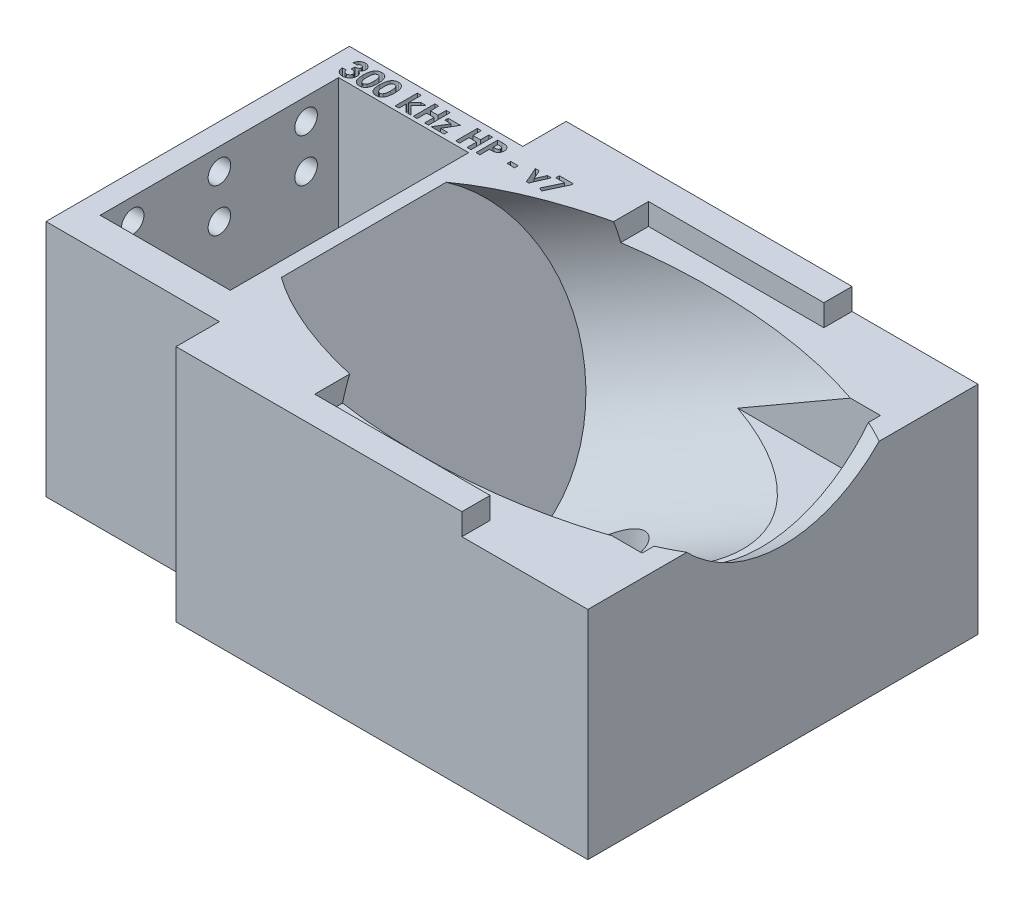
from build123d import *

# Parameters (mm, degrees)
SKETCH1_W                = 228.6
SKETCH1_H                = 127
BOSS_EXTRUDE1_DEPTH      = 50.8
SKETCH10_R               = 12.7
CUT_EXTRUDE6_DEPTH       = 196.514014843
SKETCH22_W               = 25.4
SKETCH22_H               = 101.6
CUT_EXTRUDE17_DEPTH      = 196.514014908
SKETCH23_W               = 254
SKETCH23_H               = 254
CUT_EXTRUDE18_DEPTH      = 57.15
SKETCH21_W               = 31.75
SKETCH21_H               = 101.6
CUT_EXTRUDE16_DEPTH      = 144.262530042
SKETCH26_W               = 63.5
SKETCH26_H               = 69.85
CUT_EXTRUDE21_DEPTH      = 25.4
CUT_EXTRUDE22_DEPTH      = 192.97594914
CUT_EXTRUDE22_DEPTH_BACK = 25.4
SKETCH27_R               = 3.302
SKETCH28_W               = 2.198076923
SKETCH28_H               = 1.058333333
CUT_EXTRUDE23_DEPTH      = 3.175
SKETCH30_R               = 3.429
CUT_EXTRUDE24_DEPTH      = 133.743860656
CUT_EXTRUDE25_DEPTH      = 133.743860656
CUT_EXTRUDE25_DEPTH_BACK = 38.1
SKETCH31_W               = 38.1
SKETCH31_H               = 69.85
SKETCH32_W               = 88.276157737
SKETCH32_H               = 97.79
CUT_EXTRUDE26_DEPTH      = 6.35
SKETCH33_W               = 36.899714507
SKETCH33_H               = 101.6
CUT_EXTRUDE27_DEPTH      = 6.35
BOSS_EXTRUDE2_DEPTH      = 6.35
BOSS_EXTRUDE3_DEPTH      = 6.35
SKETCH36_W               = 50.8
SKETCH36_H               = 12.7
CUT_EXTRUDE28_DEPTH      = 146.635280919


with BuildPart() as part:
    # Sketch1 → Boss-Extrude1 (new, symmetric)
    with BuildSketch(Plane.XY):
        with Locations((-25.4, -63.5)):
            Rectangle(SKETCH1_W, SKETCH1_H)
    extrude(amount=BOSS_EXTRUDE1_DEPTH, both=True)

    # Sketch10 → Cut-Extrude6 (cut, through all)
    with BuildSketch(Plane.XZ.offset(127)):
        with Locations(Location((0, 0, 0), (0, 0, 270))):
            Circle(SKETCH10_R)
    extrude(amount=-CUT_EXTRUDE6_DEPTH, mode=Mode.SUBTRACT)

    # Sketch2 → Cut-Revolve1 (revolve, cut)
    with BuildSketch(Plane.XY):
        Polygon((0, 46.586734405), (-47.920101674, 18.920050804), (-69.397531628, 6.520050839), (-50.142509297, -26.830626138), (-48.125031628, -30.324999965), (0, -2.54), (87.988181024, 48.26), (66.715681024, 85.105050804), align=None)
    revolve(axis=Axis((-48.125031628, -30.324999965, 0), (0.8660254037844379, 0.5000000000000012, 0)), mode=Mode.SUBTRACT)

    # Sketch22 → Cut-Extrude17 (cut, through all)
    with BuildSketch(Plane(origin=(0, 0, 0), x_dir=(1, 0, 0), z_dir=(0, 1, 0))):
        with Locations((-127, 0)):
            Rectangle(SKETCH22_W, SKETCH22_H)
    extrude(amount=-CUT_EXTRUDE17_DEPTH, mode=Mode.SUBTRACT)

    # Sketch23 → Cut-Extrude18 (cut)
    with BuildSketch(Plane.XZ.offset(127)):
        Rectangle(SKETCH23_W, SKETCH23_H)
    extrude(amount=-CUT_EXTRUDE18_DEPTH, mode=Mode.SUBTRACT)

    # Sketch21 → Cut-Extrude16 (cut, through all)
    with BuildSketch(Plane(origin=(0, 0, 0), x_dir=(1, 0, 0), z_dir=(0, 1, 0))):
        with Locations((73.025, 0)):
            Rectangle(SKETCH21_W, SKETCH21_H)
    extrude(amount=-CUT_EXTRUDE16_DEPTH, mode=Mode.SUBTRACT)

    # Sketch26 → Cut-Extrude21 (cut)
    with BuildSketch(Plane(origin=(0, 0, 0), x_dir=(1, 0, 0), z_dir=(0, 1, 0))):
        with Locations((19.05, 0)):
            Rectangle(SKETCH26_W, SKETCH26_H)
    extrude(amount=-CUT_EXTRUDE21_DEPTH, mode=Mode.SUBTRACT)

    # Sketch27 → Cut-Extrude22 (cut, two sides: drawn at the far end of the back side and taken through both)
    with BuildSketch(Plane.ZY.offset(114.3).offset(-CUT_EXTRUDE22_DEPTH_BACK)):
        with Locations(Location((-25.4, -6.35, 0), (0, 0, 180))):
            Circle(SKETCH27_R)
        with Locations(Location((0, -6.35, 0), (0, 0, 180))):
            Circle(SKETCH27_R)
        with Locations(Location((0, -19.05, 0), (0, 0, 180))):
            Circle(SKETCH27_R)
        with Locations(Location((25.4, -6.35, 0), (0, 0, 180))):
            Circle(SKETCH27_R)
        with Locations(Location((25.4, -19.05, 0), (0, 0, 180))):
            Circle(SKETCH27_R)
        with Locations(Location((-25.4, -19.05, 0), (0, 0, 180))):
            Circle(SKETCH27_R)
    extrude(amount=CUT_EXTRUDE22_DEPTH + CUT_EXTRUDE22_DEPTH_BACK, mode=Mode.SUBTRACT)

    # Sketch28 → Cut-Extrude23 (cut)
    # profile 1 of 11: a face of its own
    with BuildSketch(Plane(origin=(0, 0, 0), x_dir=(1, 0, 0), z_dir=(0, 1, 0))):
        with BuildLine():
            Line((-108.439595668, 40.823041991), (-109.579339258, 40.823041991))
            add(Edge.make_bspline(
                [(-109.579339258, 40.823041991), (-109.571292235, 40.880013707), (-109.555516579, 40.991702982), (-109.517767544, 41.15340123), (-109.472615625, 41.306783084), (-109.41624576, 41.451362816), (-109.35013308, 41.587397969), (-109.274949876, 41.71535535), (-109.18988339, 41.834685743), (-109.124679027, 41.906570845), (-109.092149755, 41.942433016)],
                knots=[0, 0, 0, 0, 1.111473889, 2.178970933, 3.205615836, 4.199322666, 5.174200091, 6.12565194, 7.064921805, 8, 8, 8, 8], degree=3))
            add(Edge.make_bspline(
                [(-109.092149755, 41.942433016), (-109.04523059, 41.989750553), (-108.952757848, 42.083008445), (-108.798225049, 42.202461503), (-108.636246138, 42.305840002), (-108.463572556, 42.387799223), (-108.282891233, 42.454135718), (-108.092765331, 42.498694091), (-107.893971771, 42.528258965), (-107.758320175, 42.531171208), (-107.689094867, 42.532657375)],
                knots=[0, 0, 0, 0, 1.01925491, 2.00884431, 2.983262333, 3.955970413, 4.92937149, 5.924503185, 6.940838805, 8, 8, 8, 8], degree=3))
            add(Edge.make_bspline(
                [(-107.689094867, 42.532657375), (-107.627550006, 42.531204422), (-107.506565211, 42.528348208), (-107.328748005, 42.505420072), (-107.15921418, 42.465206676), (-106.996171714, 42.412628563), (-106.84201843, 42.341087252), (-106.693352017, 42.258043018), (-106.554326218, 42.156185813), (-106.42461574, 42.041097423), (-106.305451927, 41.916618062), (-106.202255542, 41.783559862), (-106.113535759, 41.645477115), (-106.040442393, 41.501222613), (-105.984243527, 41.350552262), (-105.945239847, 41.194336462), (-105.919710992, 41.032919917), (-105.917167651, 40.923207266), (-105.915877719, 40.867563225)],
                knots=[0, 0, 0, 0, 1.091422571, 2.145516843, 3.172569842, 4.178562979, 5.178154469, 6.181868002, 7.194278174, 8.227918432, 9.254613415, 10.245994977, 11.209837596, 12.161663635, 13.10878368, 14.055455738, 15.013766427, 16, 16, 16, 16], degree=3))
            add(Edge.make_bspline(
                [(-105.915877719, 40.867563225), (-105.918524735, 40.798652714), (-105.923735896, 40.662989104), (-105.966497241, 40.464435331), (-106.033430374, 40.274582491), (-106.130121795, 40.09608691), (-106.251010699, 39.929434354), (-106.399337334, 39.780196517), (-106.570876975, 39.646033552), (-106.699654067, 39.573934358), (-106.765597271, 39.537014347)],
                knots=[0, 0, 0, 0, 0.992805628, 1.954529043, 2.915727527, 3.886831945, 4.871318353, 5.87440735, 6.911542536, 8, 8, 8, 8], degree=3))
            add(Edge.make_bspline(
                [(-106.765597271, 39.537014347), (-106.720334868, 39.522153747), (-106.631396276, 39.492953334), (-106.504980761, 39.435443453), (-106.384774052, 39.372594684), (-106.272846064, 39.299580983), (-106.16808354, 39.2193547), (-106.071125122, 39.13123003), (-105.981391508, 39.035399128), (-105.900347562, 38.931334959), (-105.828417893, 38.820701827), (-105.763879232, 38.706055293), (-105.710760316, 38.58565672), (-105.665761981, 38.460881142), (-105.631502811, 38.330607142), (-105.607381294, 38.195339519), (-105.593438465, 38.05538683), (-105.591311945, 37.960568968), (-105.590236694, 37.912625324)],
                knots=[0, 0, 0, 0, 1.059543567, 2.081955587, 3.086750234, 4.076226789, 5.052108497, 6.020845489, 6.989030705, 7.970690546, 8.952259656, 9.923888338, 10.895517021, 11.877585046, 12.873342345, 13.889638361, 14.932918083, 16, 16, 16, 16], degree=3))
            add(Edge.make_bspline(
                [(-105.590236694, 37.912625324), (-105.592416374, 37.842167634), (-105.596714258, 37.703239418), (-105.624038199, 37.498612373), (-105.674910453, 37.303518667), (-105.741835722, 37.11571345), (-105.831106766, 36.937621221), (-105.936163778, 36.765155005), (-106.065299953, 36.604295884), (-106.208812638, 36.450791159), (-106.368191842, 36.311231537), (-106.540984827, 36.190239624), (-106.723392024, 36.086407035), (-106.916567472, 36.002112782), (-107.120444057, 35.937196566), (-107.334567356, 35.890272133), (-107.559837056, 35.861562988), (-107.713601251, 35.858553379), (-107.792129723, 35.85701635)],
                knots=[0, 0, 0, 0, 1.005138573, 1.981928558, 2.936866704, 3.876260664, 4.820238198, 5.773547, 6.751179199, 7.756627054, 8.768222608, 9.766606018, 10.760583154, 11.757261445, 12.767156078, 13.807575856, 14.880313354, 16, 16, 16, 16], degree=3))
            add(Edge.make_bspline(
                [(-107.792129723, 35.85701635), (-107.86641639, 35.858636887), (-108.011674137, 35.861805633), (-108.224143994, 35.889232737), (-108.426076481, 35.933474881), (-108.617986934, 35.995837851), (-108.799132866, 36.076711966), (-108.971156979, 36.173014891), (-109.13062657, 36.290301154), (-109.279318443, 36.423276232), (-109.413934166, 36.57246672), (-109.53424892, 36.734416693), (-109.637609746, 36.909741981), (-109.724440526, 37.097693522), (-109.79406244, 37.298601039), (-109.848980002, 37.512055976), (-109.887340818, 37.738475358), (-109.899023685, 37.894256709), (-109.904980283, 37.973683016)],
                knots=[0, 0, 0, 0, 1.066544725, 2.085487077, 3.070979577, 4.031932826, 4.977951092, 5.916076795, 6.857635327, 7.814973522, 8.776389752, 9.738577119, 10.707772778, 11.69409279, 12.707140348, 13.757286496, 14.856535458, 16, 16, 16, 16], degree=3))
            Line((-109.904980283, 37.973683016), (-108.765236694, 37.973683016))
            add(Edge.make_bspline(
                [(-108.765236694, 37.973683016), (-108.758014257, 37.933746426), (-108.743946669, 37.855959444), (-108.7165087, 37.743341187), (-108.680753198, 37.639387579), (-108.639410942, 37.543174684), (-108.594755082, 37.453439261), (-108.540800124, 37.373495461), (-108.481499604, 37.301172481), (-108.395928521, 37.215194125), (-108.273598765, 37.126854954), (-108.108413067, 37.050084011), (-107.92465962, 37.005086807), (-107.796197635, 36.999597286), (-107.729799995, 36.996759939)],
                knots=[0, 0, 0, 0, 0.928156231, 1.807827665, 2.648129825, 3.438902246, 4.202261636, 4.936546065, 5.639352463, 6.338805438, 7.70633318, 9.064371875, 10.482673459, 12, 12, 12, 12], degree=3))
            add(Edge.make_bspline(
                [(-107.729799995, 36.996759939), (-107.69456706, 36.997364126), (-107.625553623, 36.998547592), (-107.524183161, 37.011664725), (-107.427613522, 37.033268655), (-107.335664841, 37.062627594), (-107.247751768, 37.09943086), (-107.165553968, 37.146886469), (-107.087396046, 37.202060389), (-107.01412765, 37.264090522), (-106.946426141, 37.331681163), (-106.890094505, 37.406526313), (-106.838611465, 37.482582364), (-106.800534238, 37.564825169), (-106.767170384, 37.648829187), (-106.746750001, 37.7376435), (-106.731331146, 37.829405024), (-106.730435064, 37.892202582), (-106.729980283, 37.924073641)],
                knots=[0, 0, 0, 0, 1.110435564, 2.175094844, 3.216326037, 4.226890168, 5.215276772, 6.21526065, 7.213097102, 8.228249917, 9.239874822, 10.221364777, 11.178138315, 12.128914389, 13.072518965, 14.022636769, 14.996447288, 16, 16, 16, 16], degree=3))
            add(Edge.make_bspline(
                [(-106.729980283, 37.924073641), (-106.73118764, 37.958930074), (-106.733591209, 38.028321246), (-106.753228623, 38.129583069), (-106.784240251, 38.226988782), (-106.827319189, 38.320107026), (-106.88484631, 38.408594586), (-106.952727671, 38.49422679), (-107.036311201, 38.572546634), (-107.128013528, 38.649963427), (-107.234352201, 38.717447522), (-107.350148378, 38.779725426), (-107.478445363, 38.829279411), (-107.616111312, 38.873540297), (-107.765750304, 38.905867762), (-107.926433137, 38.929340651), (-108.097900607, 38.94681258), (-108.216095362, 38.949319216), (-108.276775155, 38.950606093)],
                knots=[0, 0, 0, 0, 0.809814727, 1.612155564, 2.388397, 3.182215007, 3.988903953, 4.837162975, 5.715530372, 6.646997145, 7.623086902, 8.637258368, 9.698941581, 10.815059213, 11.996518529, 13.252603015, 14.589518788, 16, 16, 16, 16], degree=3))
            Line((-108.276775155, 38.950606093), (-108.276775155, 40.008939427))
            add(Edge.make_bspline(
                [(-108.276775155, 40.008939427), (-108.201225204, 40.015373502), (-108.059886206, 40.027410384), (-107.863700099, 40.055559049), (-107.698536686, 40.093184375), (-107.560426262, 40.138577293), (-107.445748216, 40.196873627), (-107.345566107, 40.261230206), (-107.259284537, 40.335970966), (-107.186365035, 40.418867149), (-107.128031703, 40.507889877), (-107.086746769, 40.601655471), (-107.059484355, 40.69726271), (-107.056901244, 40.762655179), (-107.055621309, 40.795057215)],
                knots=[0, 0, 0, 0, 1.70044513, 3.18119609, 4.440695891, 5.496282586, 6.431922213, 7.318171381, 8.16090191, 8.983045123, 9.787564368, 10.536848927, 11.275007137, 12, 12, 12, 12], degree=3))
            add(Edge.make_bspline(
                [(-107.055621309, 40.795057215), (-107.057829562, 40.836398695), (-107.062139605, 40.917088511), (-107.095613734, 41.032572635), (-107.153721029, 41.135517161), (-107.231632708, 41.225705463), (-107.326570798, 41.301037492), (-107.437854882, 41.355727261), (-107.56307009, 41.387859942), (-107.651165735, 41.391191018), (-107.696727078, 41.392913786)],
                knots=[0, 0, 0, 0, 1.009664648, 1.970651636, 2.907870547, 3.878035693, 4.867062054, 5.849714035, 6.887914197, 8, 8, 8, 8], degree=3))
            add(Edge.make_bspline(
                [(-107.696727078, 41.392913786), (-107.738023313, 41.390881101), (-107.819967691, 41.386847633), (-107.939794899, 41.356742892), (-108.053590825, 41.306065308), (-108.158999075, 41.236183907), (-108.254498061, 41.152259306), (-108.332875175, 41.052868036), (-108.398065543, 40.9439648), (-108.425698023, 40.863507611), (-108.439595668, 40.823041991)],
                knots=[0, 0, 0, 0, 0.98818071, 1.960853194, 2.938124878, 3.957524365, 4.978590984, 5.968022688, 6.978025184, 8, 8, 8, 8], degree=3))
        make_face()
    # profile 2 of 11: a face of its own
    with BuildSketch(Plane(origin=(0, 0, 0), x_dir=(1, 0, 0), z_dir=(0, 1, 0))):
        with BuildLine():
            add(Edge.make_bspline(
                [(-102.882073633, 42.532657375), (-102.826905313, 42.531838386), (-102.718429655, 42.530228034), (-102.55866543, 42.512786614), (-102.40476831, 42.486437491), (-102.25613623, 42.449689654), (-102.113839057, 42.401055199), (-101.976841125, 42.342840591), (-101.846773105, 42.271992353), (-101.721976214, 42.19196563), (-101.602498525, 42.101364034), (-101.491211599, 41.998073537), (-101.386083101, 41.884470857), (-101.289388676, 41.758838526), (-101.198986996, 41.622319302), (-101.115175106, 41.474891538), (-101.038594608, 41.315833674), (-100.968387215, 41.144858678), (-100.905607543, 40.959403708), (-100.852728303, 40.757341515), (-100.807375507, 40.538625954), (-100.769094546, 40.302712611), (-100.740160327, 40.049287898), (-100.720658081, 39.77852018), (-100.707274717, 39.490931456), (-100.70618246, 39.293647954), (-100.705621309, 39.192292792)],
                knots=[0, 0, 0, 0, 0.879237366, 1.728815576, 2.559023295, 3.367336655, 4.166867292, 4.954216142, 5.737608147, 6.525189134, 7.316157332, 8.124696809, 8.942788509, 9.781158001, 10.649253743, 11.551476218, 12.482711956, 13.461909668, 14.496590415, 15.601789533, 16.789733467, 18.056700938, 19.410929216, 20.8549011, 22.384193279, 24, 24, 24, 24], degree=3))
            add(Edge.make_bspline(
                [(-100.705621309, 39.192292792), (-100.706227762, 39.089669563), (-100.707406089, 38.89027447), (-100.720101731, 38.600055314), (-100.741964227, 38.327321659), (-100.770142189, 38.072101723), (-100.80873829, 37.834530282), (-100.853939689, 37.613992186), (-100.907653612, 37.410567376), (-100.972501226, 37.22471421), (-101.042283652, 37.053438944), (-101.119073631, 36.894691206), (-101.201532725, 36.748041017), (-101.287769572, 36.611275962), (-101.382511992, 36.488427804), (-101.481148604, 36.375319063), (-101.587974223, 36.276258196), (-101.698491078, 36.186140052), (-101.816747847, 36.10825989), (-101.94152498, 36.040147184), (-102.075047036, 35.984899691), (-102.214880136, 35.936848371), (-102.363407762, 35.902352709), (-102.518269832, 35.874981534), (-102.681214706, 35.859854544), (-102.79215414, 35.857977941), (-102.849000716, 35.85701635)],
                knots=[0, 0, 0, 0, 1.643780988, 3.193836972, 4.651895693, 6.025988579, 7.305620092, 8.505800249, 9.631074763, 10.672816429, 11.65661981, 12.592235626, 13.49536222, 14.350718032, 15.179365177, 15.97804903, 16.751647189, 17.51006938, 18.259804725, 19.016521909, 19.783502495, 20.571750527, 21.382245291, 22.22305063, 23.089471752, 24, 24, 24, 24], degree=3))
            add(Edge.make_bspline(
                [(-102.849000716, 35.85701635), (-102.905845758, 35.85799649), (-103.01720436, 35.85991657), (-103.180589853, 35.874869058), (-103.336272614, 35.90246359), (-103.485975333, 35.937113203), (-103.628656102, 35.984793372), (-103.764999071, 36.041693832), (-103.893955882, 36.109381548), (-104.015883594, 36.187443163), (-104.130365913, 36.276958349), (-104.239181892, 36.37696964), (-104.342090825, 36.487223534), (-104.437527211, 36.608954965), (-104.527054023, 36.740539073), (-104.609737636, 36.883478484), (-104.685528362, 37.037565081), (-104.756796946, 37.203013646), (-104.818720325, 37.383386097), (-104.873829257, 37.580293136), (-104.918973045, 37.795376147), (-104.955280699, 38.028566031), (-104.98426871, 38.279368765), (-105.005832458, 38.547905405), (-105.018598619, 38.834301029), (-105.019764588, 39.031155007), (-105.020364899, 39.132507135)],
                knots=[0, 0, 0, 0, 0.917216111, 1.796812873, 2.643793957, 3.46689424, 4.273913431, 5.068098542, 5.848489301, 6.620921603, 7.401012384, 8.190319798, 9.003608147, 9.831726257, 10.68377682, 11.569763213, 12.493818149, 13.453288342, 14.474581811, 15.568529029, 16.750744269, 18.018426408, 19.375425659, 20.823733699, 22.36466933, 24, 24, 24, 24], degree=3))
            add(Edge.make_bspline(
                [(-105.020364899, 39.132507135), (-105.019277492, 39.273327938), (-105.017179328, 39.545043491), (-104.990589845, 39.937593463), (-104.951563229, 40.300437914), (-104.894242373, 40.632969892), (-104.823365929, 40.936421), (-104.732604951, 41.208792261), (-104.62928018, 41.453852541), (-104.5412342, 41.599027727), (-104.498830444, 41.668945436)],
                knots=[0, 0, 0, 0, 1.288568992, 2.486310467, 3.599230591, 4.627010532, 5.572937695, 6.447898582, 7.252493626, 8, 8, 8, 8], degree=3))
            add(Edge.make_bspline(
                [(-104.498830444, 41.668945436), (-104.449525375, 41.737632572), (-104.353124251, 41.871929459), (-104.184564191, 42.048236167), (-104.003468352, 42.199022297), (-103.80611713, 42.320875424), (-103.595631717, 42.416968809), (-103.370204987, 42.484838486), (-103.130669404, 42.524382521), (-102.966176324, 42.529857901), (-102.882073633, 42.532657375)],
                knots=[0, 0, 0, 0, 1.058512271, 2.069600068, 3.047294572, 4.004278952, 4.967380941, 5.939006123, 6.946246673, 8, 8, 8, 8], degree=3))
        make_face()
        with BuildLine():
            add(Edge.make_bspline(
                [(-102.854088857, 41.392913786), (-102.903961476, 41.390549923), (-103.001738283, 41.385915496), (-103.143617089, 41.346575756), (-103.277399945, 41.285813406), (-103.37916499, 41.212695417), (-103.455335114, 41.142603057), (-103.508555726, 41.07917175), (-103.559878618, 41.008386984), (-103.60520958, 40.927054605), (-103.648013842, 40.838096982), (-103.689846508, 40.7411103), (-103.72413831, 40.633712357), (-103.757829096, 40.517732154), (-103.787345368, 40.389963146), (-103.812073533, 40.249360963), (-103.834165975, 40.095011255), (-103.849575717, 39.926812923), (-103.86394222, 39.744941945), (-103.874240811, 39.548993182), (-103.878546393, 39.339019497), (-103.879915006, 39.194413736), (-103.880621309, 39.119786782)],
                knots=[0, 0, 0, 0, 1.076674018, 2.110852608, 3.161083442, 4.239746716, 4.804137807, 5.395870207, 6.026861976, 6.692161227, 7.405688833, 8.16177676, 8.973626916, 9.841385931, 10.773283133, 11.807421078, 12.927755683, 14.143907515, 15.458935494, 16.872852025, 18.386167141, 20, 20, 20, 20], degree=3))
            add(Edge.make_bspline(
                [(-103.880621309, 39.119786782), (-103.87945882, 39.023103956), (-103.877229662, 38.837707467), (-103.865554372, 38.571100861), (-103.842152222, 38.328467382), (-103.813044673, 38.108162613), (-103.772161932, 37.911615289), (-103.725123692, 37.73696589), (-103.667035647, 37.586440772), (-103.59990372, 37.457863004), (-103.525552085, 37.348482163), (-103.444840115, 37.255507956), (-103.360515762, 37.174996679), (-103.26994699, 37.109598361), (-103.173349869, 37.059480104), (-103.071530807, 37.023430661), (-102.964425099, 37.001363296), (-102.891080214, 36.998303262), (-102.854088857, 36.996759939)],
                knots=[0, 0, 0, 0, 1.771748488, 3.397459088, 4.888034009, 6.237357457, 7.467047327, 8.564189669, 9.548206622, 10.417051504, 11.216568818, 11.965764335, 12.669334354, 13.348544111, 14.005342236, 14.656555988, 15.322436492, 16, 16, 16, 16], degree=3))
            add(Edge.make_bspline(
                [(-102.854088857, 36.996759939), (-102.818366926, 36.997815995), (-102.748427827, 36.999883622), (-102.646440957, 37.021107527), (-102.549994925, 37.055612988), (-102.459380933, 37.104423385), (-102.374274868, 37.166493273), (-102.295092674, 37.242095413), (-102.222431528, 37.331983383), (-102.180098815, 37.398693551), (-102.158285572, 37.433068032)],
                knots=[0, 0, 0, 0, 0.992283464, 1.942767638, 2.88273346, 3.832339453, 4.79467288, 5.803907806, 6.868395428, 8, 8, 8, 8], degree=3))
            add(Edge.make_bspline(
                [(-102.158285572, 37.433068032), (-102.132604152, 37.480039663), (-102.078752298, 37.578535363), (-102.01643484, 37.744743184), (-101.963979477, 37.932198135), (-101.918831912, 38.141483595), (-101.887953733, 38.373425011), (-101.861361482, 38.626551622), (-101.848535379, 38.902138072), (-101.846449143, 39.093065359), (-101.845364899, 39.192292792)],
                knots=[0, 0, 0, 0, 0.710965849, 1.490837728, 2.352621235, 3.297892224, 4.334225155, 5.461620853, 6.680770821, 8, 8, 8, 8], degree=3))
            add(Edge.make_bspline(
                [(-101.845364899, 39.192292792), (-101.845783719, 39.292381567), (-101.846589876, 39.485035374), (-101.861380526, 39.761612576), (-101.881977637, 40.014219949), (-101.912105264, 40.242293522), (-101.950869932, 40.446386958), (-101.998647532, 40.626486915), (-102.054973767, 40.782948336), (-102.12176997, 40.915615207), (-102.195750915, 41.028363849), (-102.274283947, 41.125093438), (-102.357701135, 41.20767872), (-102.445862978, 41.27643048), (-102.540810013, 41.32896198), (-102.640728629, 41.366053565), (-102.745823665, 41.38849273), (-102.817513358, 41.391420209), (-102.854088857, 41.392913786)],
                knots=[0, 0, 0, 0, 1.793836731, 3.452829483, 4.963243077, 6.335886805, 7.574563692, 8.684454726, 9.672768357, 10.54971625, 11.340229787, 12.085688095, 12.778991901, 13.440269426, 14.083255152, 14.715733572, 15.344777694, 16, 16, 16, 16], degree=3))
        make_face(mode=Mode.SUBTRACT)
    # profile 3 of 11: a face of its own
    with BuildSketch(Plane(origin=(0, 0, 0), x_dir=(1, 0, 0), z_dir=(0, 1, 0))):
        with BuildLine():
            add(Edge.make_bspline(
                [(-97.997458248, 42.532657375), (-97.942289928, 42.531838386), (-97.83381427, 42.530228034), (-97.674050046, 42.512786614), (-97.520152926, 42.486437491), (-97.371520845, 42.449689654), (-97.229223673, 42.401055199), (-97.092225741, 42.342840591), (-96.962157721, 42.271992353), (-96.83736083, 42.19196563), (-96.71788314, 42.101364034), (-96.606596214, 41.998073537), (-96.501467716, 41.884470857), (-96.404773291, 41.758838526), (-96.314371611, 41.622319302), (-96.230559722, 41.474891538), (-96.153979223, 41.315833674), (-96.083771831, 41.144858678), (-96.020992158, 40.959403708), (-95.968112919, 40.757341515), (-95.922760122, 40.538625954), (-95.884479162, 40.302712611), (-95.855544943, 40.049287898), (-95.836042697, 39.77852018), (-95.822659333, 39.490931456), (-95.821567076, 39.293647954), (-95.821005924, 39.192292792)],
                knots=[0, 0, 0, 0, 0.879237366, 1.728815576, 2.559023295, 3.367336655, 4.166867292, 4.954216142, 5.737608147, 6.525189134, 7.316157332, 8.124696809, 8.942788509, 9.781158001, 10.649253743, 11.551476218, 12.482711956, 13.461909668, 14.496590415, 15.601789533, 16.789733467, 18.056700938, 19.410929216, 20.8549011, 22.384193279, 24, 24, 24, 24], degree=3))
            add(Edge.make_bspline(
                [(-95.821005924, 39.192292792), (-95.821612377, 39.089669563), (-95.822790704, 38.89027447), (-95.835486347, 38.600055314), (-95.857348842, 38.327321659), (-95.885526805, 38.072101723), (-95.924122905, 37.834530282), (-95.969324304, 37.613992186), (-96.023038227, 37.410567376), (-96.087885842, 37.22471421), (-96.157668267, 37.053438944), (-96.234458246, 36.894691206), (-96.316917341, 36.748041017), (-96.403154187, 36.611275962), (-96.497896607, 36.488427804), (-96.59653322, 36.375319063), (-96.703358839, 36.276258196), (-96.813875693, 36.186140052), (-96.932132462, 36.10825989), (-97.056909595, 36.040147184), (-97.190431651, 35.984899691), (-97.330264751, 35.936848371), (-97.478792377, 35.902352709), (-97.633654447, 35.874981534), (-97.796599321, 35.859854544), (-97.907538755, 35.857977941), (-97.964385332, 35.85701635)],
                knots=[0, 0, 0, 0, 1.643780988, 3.193836972, 4.651895693, 6.025988579, 7.305620092, 8.505800249, 9.631074763, 10.672816429, 11.65661981, 12.592235626, 13.49536222, 14.350718032, 15.179365177, 15.97804903, 16.751647189, 17.51006938, 18.259804725, 19.016521909, 19.783502495, 20.571750527, 21.382245291, 22.22305063, 23.089471752, 24, 24, 24, 24], degree=3))
            add(Edge.make_bspline(
                [(-97.964385332, 35.85701635), (-98.021230374, 35.85799649), (-98.132588975, 35.85991657), (-98.295974469, 35.874869058), (-98.451657229, 35.90246359), (-98.601359948, 35.937113203), (-98.744040717, 35.984793372), (-98.880383687, 36.041693832), (-99.009340497, 36.109381548), (-99.131268209, 36.187443163), (-99.245750528, 36.276958349), (-99.354566507, 36.37696964), (-99.45747544, 36.487223534), (-99.552911827, 36.608954965), (-99.642438638, 36.740539073), (-99.725122252, 36.883478484), (-99.800912977, 37.037565081), (-99.872181562, 37.203013646), (-99.93410494, 37.383386097), (-99.989213872, 37.580293136), (-100.03435766, 37.795376147), (-100.070665315, 38.028566031), (-100.099653325, 38.279368765), (-100.121217073, 38.547905405), (-100.133983234, 38.834301029), (-100.135149204, 39.031155007), (-100.135749514, 39.132507135)],
                knots=[0, 0, 0, 0, 0.917216111, 1.796812873, 2.643793957, 3.46689424, 4.273913431, 5.068098542, 5.848489301, 6.620921603, 7.401012384, 8.190319798, 9.003608147, 9.831726257, 10.68377682, 11.569763213, 12.493818149, 13.453288342, 14.474581811, 15.568529029, 16.750744269, 18.018426408, 19.375425659, 20.823733699, 22.36466933, 24, 24, 24, 24], degree=3))
            add(Edge.make_bspline(
                [(-100.135749514, 39.132507135), (-100.134662108, 39.273327938), (-100.132563943, 39.545043491), (-100.105974461, 39.937593463), (-100.066947844, 40.300437914), (-100.009626989, 40.632969892), (-99.938750544, 40.936421), (-99.847989566, 41.208792261), (-99.744664795, 41.453852541), (-99.656618816, 41.599027727), (-99.614215059, 41.668945436)],
                knots=[0, 0, 0, 0, 1.288568992, 2.486310467, 3.599230591, 4.627010532, 5.572937695, 6.447898582, 7.252493626, 8, 8, 8, 8], degree=3))
            add(Edge.make_bspline(
                [(-99.614215059, 41.668945436), (-99.564909991, 41.737632572), (-99.468508867, 41.871929459), (-99.299948806, 42.048236167), (-99.118852968, 42.199022297), (-98.921501746, 42.320875424), (-98.711016332, 42.416968809), (-98.485589602, 42.484838486), (-98.246054019, 42.524382521), (-98.081560939, 42.529857901), (-97.997458248, 42.532657375)],
                knots=[0, 0, 0, 0, 1.058512271, 2.069600068, 3.047294572, 4.004278952, 4.967380941, 5.939006123, 6.946246673, 8, 8, 8, 8], degree=3))
        make_face()
        with BuildLine():
            add(Edge.make_bspline(
                [(-97.969473473, 41.392913786), (-98.019346092, 41.390549923), (-98.117122899, 41.385915496), (-98.259001705, 41.346575756), (-98.39278456, 41.285813406), (-98.494549605, 41.212695417), (-98.570719729, 41.142603057), (-98.623940341, 41.07917175), (-98.675263233, 41.008386984), (-98.720594196, 40.927054605), (-98.763398458, 40.838096982), (-98.805231124, 40.7411103), (-98.839522925, 40.633712357), (-98.873213711, 40.517732154), (-98.902729983, 40.389963146), (-98.927458148, 40.249360963), (-98.94955059, 40.095011255), (-98.964960332, 39.926812923), (-98.979326836, 39.744941945), (-98.989625426, 39.548993182), (-98.993931008, 39.339019497), (-98.995299622, 39.194413736), (-98.996005924, 39.119786782)],
                knots=[0, 0, 0, 0, 1.076674018, 2.110852608, 3.161083442, 4.239746716, 4.804137807, 5.395870207, 6.026861976, 6.692161227, 7.405688833, 8.16177676, 8.973626916, 9.841385931, 10.773283133, 11.807421078, 12.927755683, 14.143907515, 15.458935494, 16.872852025, 18.386167141, 20, 20, 20, 20], degree=3))
            add(Edge.make_bspline(
                [(-98.996005924, 39.119786782), (-98.994843436, 39.023103956), (-98.992614277, 38.837707467), (-98.980938987, 38.571100861), (-98.957536838, 38.328467382), (-98.928429289, 38.108162613), (-98.887546547, 37.911615289), (-98.840508307, 37.73696589), (-98.782420263, 37.586440772), (-98.715288335, 37.457863004), (-98.6409367, 37.348482163), (-98.56022473, 37.255507956), (-98.475900378, 37.174996679), (-98.385331606, 37.109598361), (-98.288734485, 37.059480104), (-98.186915422, 37.023430661), (-98.079809714, 37.001363296), (-98.00646483, 36.998303262), (-97.969473473, 36.996759939)],
                knots=[0, 0, 0, 0, 1.771748488, 3.397459088, 4.888034009, 6.237357457, 7.467047327, 8.564189669, 9.548206622, 10.417051504, 11.216568818, 11.965764335, 12.669334354, 13.348544111, 14.005342236, 14.656555988, 15.322436492, 16, 16, 16, 16], degree=3))
            add(Edge.make_bspline(
                [(-97.969473473, 36.996759939), (-97.933751541, 36.997815995), (-97.863812442, 36.999883622), (-97.761825572, 37.021107527), (-97.665379541, 37.055612988), (-97.574765549, 37.104423385), (-97.489659483, 37.166493273), (-97.410477289, 37.242095413), (-97.337816143, 37.331983383), (-97.29548343, 37.398693551), (-97.273670187, 37.433068032)],
                knots=[0, 0, 0, 0, 0.992283464, 1.942767638, 2.88273346, 3.832339453, 4.79467288, 5.803907806, 6.868395428, 8, 8, 8, 8], degree=3))
            add(Edge.make_bspline(
                [(-97.273670187, 37.433068032), (-97.247988768, 37.480039663), (-97.194136914, 37.578535363), (-97.131819455, 37.744743184), (-97.079364092, 37.932198135), (-97.034216528, 38.141483595), (-97.003338348, 38.373425011), (-96.976746097, 38.626551622), (-96.963919994, 38.902138072), (-96.961833758, 39.093065359), (-96.960749514, 39.192292792)],
                knots=[0, 0, 0, 0, 0.710965849, 1.490837728, 2.352621235, 3.297892224, 4.334225155, 5.461620853, 6.680770821, 8, 8, 8, 8], degree=3))
            add(Edge.make_bspline(
                [(-96.960749514, 39.192292792), (-96.961168334, 39.292381567), (-96.961974492, 39.485035374), (-96.976765142, 39.761612576), (-96.997362252, 40.014219949), (-97.027489879, 40.242293522), (-97.066254547, 40.446386958), (-97.114032147, 40.626486915), (-97.170358383, 40.782948336), (-97.237154586, 40.915615207), (-97.311135531, 41.028363849), (-97.389668562, 41.125093438), (-97.47308575, 41.20767872), (-97.561247593, 41.27643048), (-97.656194629, 41.32896198), (-97.756113244, 41.366053565), (-97.86120828, 41.38849273), (-97.932897973, 41.391420209), (-97.969473473, 41.392913786)],
                knots=[0, 0, 0, 0, 1.793836731, 3.452829483, 4.963243077, 6.335886805, 7.574563692, 8.684454726, 9.672768357, 10.54971625, 11.340229787, 12.085688095, 12.778991901, 13.440269426, 14.083255152, 14.715733572, 15.344777694, 16, 16, 16, 16], degree=3))
        make_face(mode=Mode.SUBTRACT)
    # profile 4 of 11: a face of its own
    with BuildSketch(Plane(origin=(0, 0, 0), x_dir=(1, 0, 0), z_dir=(0, 1, 0))):
        Polygon((-92.483185412, 42.532657375), (-91.343441822, 42.532657375), (-91.343441822, 38.7343601), (-89.570224674, 40.660221478), (-88.162081646, 40.660221478), (-90.198610091, 38.448152167), (-87.870785572, 36.019836863), (-89.305641341, 36.019836863), (-91.343441822, 38.145407776), (-91.343441822, 36.019836863), (-92.483185412, 36.019836863), align=None)
    # profile 5 of 11: a face of its own
    with BuildSketch(Plane(origin=(0, 0, 0), x_dir=(1, 0, 0), z_dir=(0, 1, 0))):
        Polygon((-87.191518745, 42.369836863), (-86.051775155, 42.369836863), (-86.051775155, 39.92752917), (-83.853698232, 39.92752917), (-83.853698232, 42.369836863), (-82.713954642, 42.369836863), (-82.713954642, 36.019836863), (-83.853698232, 36.019836863), (-83.853698232, 38.78778558), (-86.051775155, 38.78778558), (-86.051775155, 36.019836863), (-87.191518745, 36.019836863), align=None)
    # profile 6 of 11: a face of its own
    with BuildSketch(Plane(origin=(0, 0, 0), x_dir=(1, 0, 0), z_dir=(0, 1, 0))):
        Polygon((-81.574211053, 40.660221478), (-77.992159771, 40.660221478), (-80.126634931, 36.996759939), (-78.154980283, 36.996759939), (-78.154980283, 36.019836863), (-81.899852078, 36.019836863), (-79.765376918, 39.683298401), (-81.574211053, 39.683298401), align=None)
    # profile 7 of 11: a face of its own
    with BuildSketch(Plane(origin=(0, 0, 0), x_dir=(1, 0, 0), z_dir=(0, 1, 0))):
        Polygon((-74.735749514, 42.369836863), (-73.596005924, 42.369836863), (-73.596005924, 39.92752917), (-71.397929001, 39.92752917), (-71.397929001, 42.369836863), (-70.258185412, 42.369836863), (-70.258185412, 36.019836863), (-71.397929001, 36.019836863), (-71.397929001, 38.78778558), (-73.596005924, 38.78778558), (-73.596005924, 36.019836863), (-74.735749514, 36.019836863), align=None)
    # profile 8 of 11: a face of its own
    with BuildSketch(Plane(origin=(0, 0, 0), x_dir=(1, 0, 0), z_dir=(0, 1, 0))):
        with BuildLine():
            Line((-68.792800796, 42.369836863), (-67.52076554, 42.369836863))
            add(Edge.make_bspline(
                [(-67.52076554, 42.369836863), (-67.437652406, 42.36946483), (-67.27730975, 42.368747103), (-67.046082448, 42.360043698), (-66.832763941, 42.344446666), (-66.637403237, 42.325171201), (-66.460080665, 42.298147749), (-66.300574163, 42.267167478), (-66.158850631, 42.229424491), (-66.033311923, 42.184624088), (-65.920644989, 42.131806163), (-65.81402573, 42.075551303), (-65.715863754, 42.008413112), (-65.62120453, 41.937627459), (-65.535459889, 41.856432217), (-65.453280566, 41.770231048), (-65.378147081, 41.675605284), (-65.309711291, 41.573700345), (-65.247629486, 41.466398998), (-65.193390667, 41.35350942), (-65.149395174, 41.234852976), (-65.112488427, 41.111197237), (-65.082844568, 40.982547592), (-65.063112671, 40.848112836), (-65.049709775, 40.708831642), (-65.048527154, 40.614036774), (-65.047929001, 40.566090869)],
                knots=[0, 0, 0, 0, 1.698747864, 3.27724071, 4.728299578, 6.070144658, 7.288476769, 8.393259625, 9.389771311, 10.283485332, 11.113357557, 11.931608583, 12.74405601, 13.541433047, 14.344816069, 15.154114104, 15.974336324, 16.810834471, 17.661136416, 18.50621059, 19.367396281, 20.244825668, 21.142564693, 22.063065223, 23.020325768, 24, 24, 24, 24], degree=3))
            add(Edge.make_bspline(
                [(-65.047929001, 40.566090869), (-65.048794454, 40.513049456), (-65.050495173, 40.408816563), (-65.067167709, 40.256023928), (-65.095649666, 40.110349985), (-65.132874095, 39.970566238), (-65.184780914, 39.838972441), (-65.244082017, 39.712428724), (-65.317041184, 39.594482986), (-65.400408695, 39.483659867), (-65.491455529, 39.379058322), (-65.592343132, 39.283698524), (-65.701148544, 39.196930408), (-65.817241929, 39.117844638), (-65.941059137, 39.046600746), (-66.072510828, 38.982531611), (-66.212494627, 38.92768636), (-66.309975134, 38.899002739), (-66.359397351, 38.88446026)],
                knots=[0, 0, 0, 0, 1.102006807, 2.165578795, 3.188629044, 4.184801286, 5.166646146, 6.124351954, 7.085497154, 8.042432466, 9.003981491, 9.963833307, 10.922997304, 11.89326795, 12.880200226, 13.889073926, 14.929769137, 16, 16, 16, 16], degree=3))
            add(Edge.make_bspline(
                [(-66.359397351, 38.88446026), (-66.391949666, 38.876361191), (-66.462468463, 38.858816), (-66.579157703, 38.841003228), (-66.7136298, 38.824625479), (-66.866319591, 38.810550787), (-67.037315104, 38.800983275), (-67.226450772, 38.793511474), (-67.433812308, 38.788078704), (-67.57800332, 38.787885925), (-67.653057207, 38.78778558)],
                knots=[0, 0, 0, 0, 0.618981996, 1.340914327, 2.176866532, 3.120127938, 4.170906482, 5.338178032, 6.614476169, 8, 8, 8, 8], degree=3))
            Line((-67.653057207, 38.78778558), (-67.653057207, 36.019836863))
            Line((-67.653057207, 36.019836863), (-68.792800796, 36.019836863))
            Line((-68.792800796, 36.019836863), (-68.792800796, 42.369836863))
        make_face()
        with BuildLine():
            Line((-67.653057207, 39.92752917), (-67.24982203, 39.92752917))
            add(Edge.make_bspline(
                [(-67.24982203, 39.92752917), (-67.176447024, 39.927994425), (-67.041435922, 39.9288505), (-66.857058433, 39.941229845), (-66.708889137, 39.960135604), (-66.591832641, 39.987250836), (-66.499405451, 40.028401791), (-66.419692785, 40.076005697), (-66.351321197, 40.136199528), (-66.292121465, 40.204981281), (-66.244793064, 40.284014961), (-66.211973282, 40.372013661), (-66.190654198, 40.467128431), (-66.188685182, 40.533322016), (-66.187672591, 40.567362904)],
                knots=[0, 0, 0, 0, 1.8619151, 3.425951444, 4.686033666, 5.651700536, 6.461346321, 7.243864085, 7.999046032, 8.762387399, 9.539336099, 10.322741239, 11.137448474, 12, 12, 12, 12], degree=3))
            add(Edge.make_bspline(
                [(-66.187672591, 40.567362904), (-66.188674766, 40.597103985), (-66.190619227, 40.654808832), (-66.204903766, 40.738091239), (-66.227669213, 40.815727623), (-66.260655469, 40.886907175), (-66.303298889, 40.951508948), (-66.355289846, 41.009507495), (-66.415961196, 41.062144902), (-66.462803025, 41.090006686), (-66.486600876, 41.104161782)],
                knots=[0, 0, 0, 0, 1.102301479, 2.1387299, 3.123554645, 4.094223062, 5.036071848, 5.982632524, 6.975082478, 8, 8, 8, 8], degree=3))
            add(Edge.make_bspline(
                [(-66.486600876, 41.104161782), (-66.50675903, 41.114356339), (-66.549437973, 41.135940304), (-66.62212435, 41.161033242), (-66.706003319, 41.182201899), (-66.801641158, 41.19977168), (-66.90865634, 41.213407654), (-67.027029772, 41.223835764), (-67.15693565, 41.228029313), (-67.247277416, 41.22938631), (-67.294343264, 41.230093273)],
                knots=[0, 0, 0, 0, 0.656809284, 1.390599849, 2.23162475, 3.173112763, 4.218524733, 5.370385145, 6.63003504, 8, 8, 8, 8], degree=3))
            Line((-67.294343264, 41.230093273), (-67.653057207, 41.230093273))
            Line((-67.653057207, 41.230093273), (-67.653057207, 39.92752917))
        make_face(mode=Mode.SUBTRACT)
    # profile 9 of 11: a face of its own
    with BuildSketch(Plane(origin=(0, 0, 0), x_dir=(1, 0, 0), z_dir=(0, 1, 0))):
        with Locations((-60.366839258, 38.340029171)):
            Rectangle(SKETCH28_W, SKETCH28_H)
    # profile 10 of 11: a face of its own
    with BuildSketch(Plane(origin=(0, 0, 0), x_dir=(1, 0, 0), z_dir=(0, 1, 0))):
        Polygon((-56.052095668, 40.660221478), (-54.891999514, 40.660221478), (-53.691198232, 37.921529571), (-52.49039695, 40.660221478), (-51.330300796, 40.660221478), (-53.363013136, 36.019836863), (-54.019383328, 36.019836863), align=None)
    # profile 11 of 11: a face of its own
    with BuildSketch(Plane(origin=(0, 0, 0), x_dir=(1, 0, 0), z_dir=(0, 1, 0))):
        Polygon((-50.719723873, 42.369836863), (-46.649211053, 42.369836863), (-46.649211053, 41.778340468), (-49.450232687, 35.85701635), (-50.460228681, 36.365830452), (-48.119683809, 41.311503529), (-50.719723873, 41.311503529), align=None)
    extrude(amount=-CUT_EXTRUDE23_DEPTH, mode=Mode.SUBTRACT)

    # Sketch30 → Cut-Extrude24 (cut, through all)
    with BuildSketch(Plane(origin=(0, -25.4, 0), x_dir=(1, 0, 0), z_dir=(0, 1, 0))):
        with Locations(Location((-95.25, 25.4, 0), (0, 0, 270))):
            Circle(SKETCH30_R)
        with Locations(Location((-82.55, 25.4, 0), (0, 0, 270))):
            Circle(SKETCH30_R)
        with Locations(Location((-82.55, 12.7, 0), (0, 0, 270))):
            Circle(SKETCH30_R)
        with Locations(Location((-82.55, 0, 0), (0, 0, 270))):
            Circle(SKETCH30_R)
        with Locations(Location((-82.55, -12.7, 0), (0, 0, 270))):
            Circle(SKETCH30_R)
        with Locations(Location((-82.55, -25.4, 0), (0, 0, 270))):
            Circle(SKETCH30_R)
        with Locations(Location((-95.25, 12.7, 0), (0, 0, 270))):
            Circle(SKETCH30_R)
        with Locations(Location((-95.25, 0, 0), (0, 0, 270))):
            Circle(SKETCH30_R)
        with Locations(Location((-95.25, -12.7, 0), (0, 0, 270))):
            Circle(SKETCH30_R)
        with Locations(Location((-95.25, -25.4, 0), (0, 0, 270))):
            Circle(SKETCH30_R)
    extrude(amount=-CUT_EXTRUDE24_DEPTH, mode=Mode.SUBTRACT)

    # Sketch31 → Cut-Extrude25 (cut, two sides: drawn at the far end of the back side and taken through both)
    with BuildSketch(Plane(origin=(0, -25.4, 0), x_dir=(1, 0, 0), z_dir=(0, 1, 0)).offset(-CUT_EXTRUDE25_DEPTH_BACK)):
        with Locations((-88.9, 0)):
            Rectangle(SKETCH31_W, SKETCH31_H)
    extrude(amount=CUT_EXTRUDE25_DEPTH + CUT_EXTRUDE25_DEPTH_BACK, mode=Mode.SUBTRACT)

    # Sketch32 → Cut-Extrude26 (cut)
    with BuildSketch(Plane(origin=(0, 0, 0), x_dir=(1, 0, 0), z_dir=(0, 1, 0))):
        with Locations((13.011921132, 0)):
            Rectangle(SKETCH32_W, SKETCH32_H)
    extrude(amount=-CUT_EXTRUDE26_DEPTH, mode=Mode.SUBTRACT)

    # Sketch33 → Cut-Extrude27 (cut)
    with BuildSketch(Plane(origin=(0, 0, 0), x_dir=(1, 0, 0), z_dir=(0, 1, 0))):
        with Locations((38.700142747, 0)):
            Rectangle(SKETCH33_W, SKETCH33_H)
    extrude(amount=-CUT_EXTRUDE27_DEPTH, mode=Mode.SUBTRACT)

    # Sketch34 → Boss-Extrude2 (add)
    with BuildSketch(Plane.XY.offset(50.8)):
        Polygon((57.15, -6.35), (20.250285493, -6.35), (20.250285493, 0), (-114.3, 0), (-114.3, -69.85), (57.15, -69.85), align=None)
    extrude(amount=BOSS_EXTRUDE2_DEPTH)

    # Sketch35 → Boss-Extrude3 (add)
    with BuildSketch(Plane(origin=(0, 0, -50.8), x_dir=(-1, 0, 0), z_dir=(0, 0, -1))):
        Polygon((-20.250285493, 0), (-20.250285493, -6.35), (-57.15, -6.35), (-57.15, -69.85), (114.3, -69.85), (114.3, 0), align=None)
    extrude(amount=BOSS_EXTRUDE3_DEPTH)

    # Sketch36 → Cut-Extrude28 (cut, through all)
    with BuildSketch(Plane(origin=(0, 0, 0), x_dir=(1, 0, 0), z_dir=(0, 1, 0))):
        with Locations((-88.9, 50.8)):
            Rectangle(SKETCH36_W, SKETCH36_H)
        with Locations((-88.9, -50.8)):
            Rectangle(SKETCH36_W, SKETCH36_H)
    extrude(amount=-CUT_EXTRUDE28_DEPTH, mode=Mode.SUBTRACT)


solid = part.part
